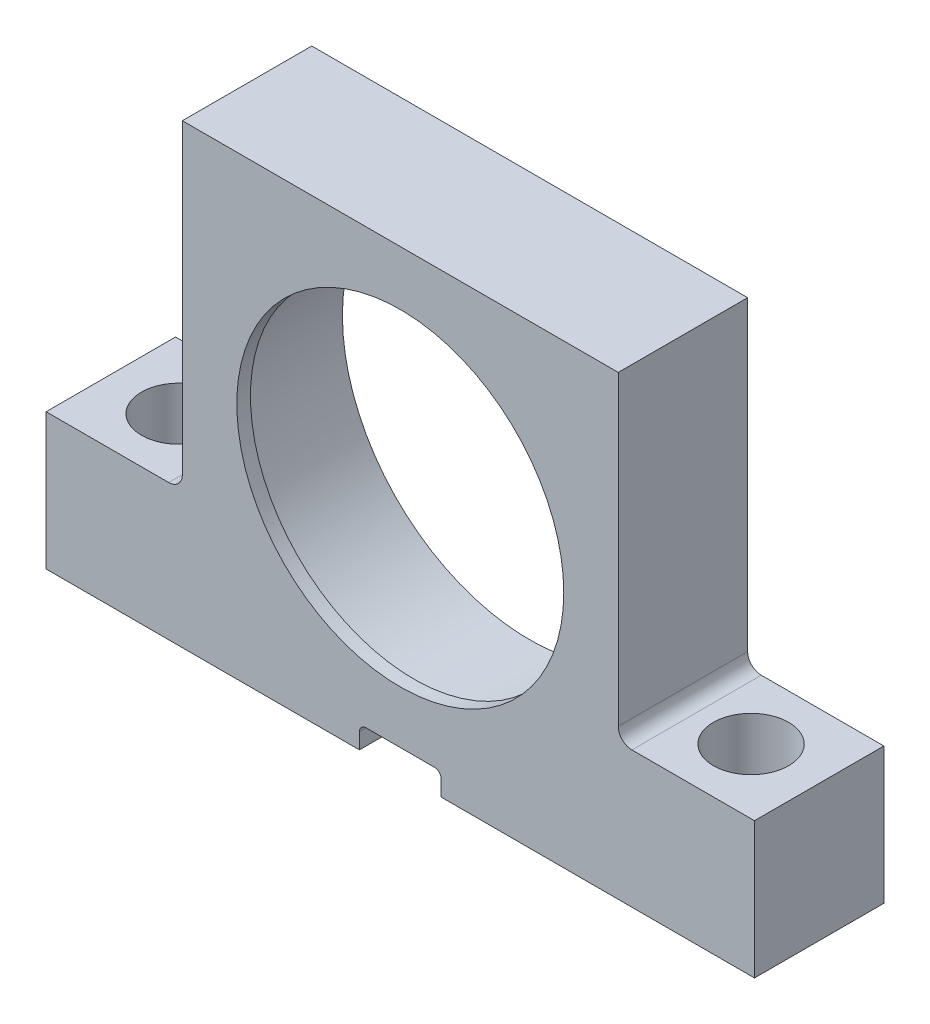
from build123d import *

# Parameters (mm, degrees)
EXTRUDE_1_DEPTH     = 19
SKETCH_3_R          = 27.5
CUT_EXTRUDE_1_DEPTH = 19
SKETCH_4_R          = 5.5
SKETCH_4_R_2        = 5.523267564
CUT_EXTRUDE_2_DEPTH = 30
SKETCH_5_R          = 27.5
SKETCH_5_R_2        = 24
EXTRUDE_2_DEPTH     = 2
SKETCH_6_W          = 12
SKETCH_6_H          = 6.6
CUT_EXTRUDE_3_DEPTH = 30
FILLET_1_R          = 1
FILLET_2_R          = 2


with BuildPart() as part:
    # 草图2 → 凸台-拉伸1 (new body)
    with BuildSketch(Plane.XY):
        Polygon((32, 10), (52, 10), (52, -10), (-52, -10), (-52, 10), (-32, 10), (-32, 57), (32, 57), align=None)
    extrude(amount=EXTRUDE_1_DEPTH)

    # 草图3 → 切除-拉伸1 (cut)
    with BuildSketch(Plane.XY.offset(19)):
        with Locations((0, 25)):
            Circle(SKETCH_3_R)
    extrude(amount=-CUT_EXTRUDE_1_DEPTH, mode=Mode.SUBTRACT)

    # 草图4 → 切除-拉伸2 (cut)
    with BuildSketch(Plane(origin=(0, 10, 0), x_dir=(1, 0, 0), z_dir=(0, 1, 0))):
        with Locations(Location((-42, -9.5, 0), (0, 0, 270))):
            Circle(SKETCH_4_R)
        with Locations(Location((42, -9.5, 0), (0, 0, 270))):
            Circle(SKETCH_4_R_2)
    extrude(amount=-CUT_EXTRUDE_2_DEPTH, mode=Mode.SUBTRACT)

    # 草图5 → 凸台-拉伸2 (add)
    with BuildSketch(Plane.XY.offset(19)):
        with Locations((0, 25)):
            Circle(SKETCH_5_R)
        with Locations((0, 25)):
            Circle(SKETCH_5_R_2, mode=Mode.SUBTRACT)
    extrude(amount=-EXTRUDE_2_DEPTH)

    # 草图6 → 切除-拉伸3 (cut)
    with BuildSketch(Plane(origin=(0, 0, 0), x_dir=(-1, 0, 0), z_dir=(0, 0, -1))):
        with Locations((0, -10)):
            Rectangle(SKETCH_6_W, SKETCH_6_H)
    extrude(amount=-CUT_EXTRUDE_3_DEPTH, mode=Mode.SUBTRACT)

    # 圆角1
    fillet_1_edges = [part.edges().sort_by_distance(p)[0] for p in [
        (-6, -6.7, 9.5),
        (6, -6.7, 9.5),
    ]]
    fillet(fillet_1_edges, radius=FILLET_1_R)

    # 圆角2
    fillet_2_edges = [part.edges().sort_by_distance(p)[0] for p in [
        (-32, 10, 9.5),
        (32, 10, 9.5),
    ]]
    fillet(fillet_2_edges, radius=FILLET_2_R)


solid = part.part
